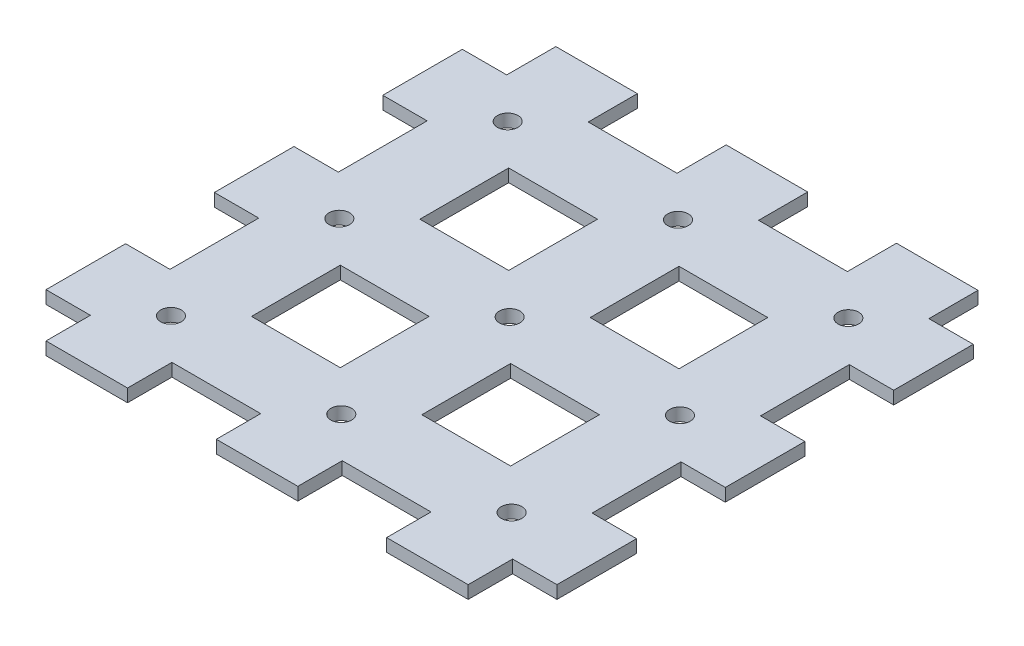
from build123d import *

# Parameters (mm, degrees)
SKETCH2_W           = 126.6
SKETCH2_H           = 126.33
BOSS_EXTRUDE1_DEPTH = 3.175
SKETCH3_W           = 22
SKETCH3_H           = 22
CUT_EXTRUDE1_DEPTH  = 90.48065629
SKETCH4_R           = 2.55
CUT_EXTRUDE2_DEPTH  = 90.48065629


with BuildPart() as part:
    # Sketch2 → Boss-Extrude1 (new body)
    with BuildSketch(Plane(origin=(0, 0, 0), x_dir=(1, 0, 0), z_dir=(0, 1, 0))):
        Rectangle(SKETCH2_W, SKETCH2_H)
    extrude(amount=BOSS_EXTRUDE1_DEPTH)

    # Sketch3 → Cut-Extrude1 (cut, through all)
    with BuildSketch(Plane(origin=(0, 3.175, 0), x_dir=(1, 0, 0), z_dir=(0, 1, 0))):
        with Locations((63.3, -63.165)):
            Rectangle(SKETCH3_W, SKETCH3_H)
        with Locations((21.1, -63.165)):
            Rectangle(SKETCH3_W, SKETCH3_H)
        with Locations((-21.1, -63.165)):
            Rectangle(SKETCH3_W, SKETCH3_H)
        with Locations((-63.3, -63.165)):
            Rectangle(SKETCH3_W, SKETCH3_H)
        with Locations((21.1, -21.445)):
            Rectangle(SKETCH3_W, SKETCH3_H)
        with Locations((-21.1, -21.445)):
            Rectangle(SKETCH3_W, SKETCH3_H)
        with Locations((-63.3, -21.445)):
            Rectangle(SKETCH3_W, SKETCH3_H)
        with Locations((21.1, 20.275)):
            Rectangle(SKETCH3_W, SKETCH3_H)
        with Locations((-21.1, 20.275)):
            Rectangle(SKETCH3_W, SKETCH3_H)
        with Locations((-63.3, 20.275)):
            Rectangle(SKETCH3_W, SKETCH3_H)
        with Locations((21.1, 61.995)):
            Rectangle(SKETCH3_W, SKETCH3_H)
        with Locations((-21.1, 61.995)):
            Rectangle(SKETCH3_W, SKETCH3_H)
        with Locations((-63.3, 61.995)):
            Rectangle(SKETCH3_W, SKETCH3_H)
        with Locations((63.3, -21.445)):
            Rectangle(SKETCH3_W, SKETCH3_H)
        with Locations((63.3, 20.275)):
            Rectangle(SKETCH3_W, SKETCH3_H)
        with Locations((63.3, 61.995)):
            Rectangle(SKETCH3_W, SKETCH3_H)
    extrude(amount=-CUT_EXTRUDE1_DEPTH, mode=Mode.SUBTRACT)

    # Sketch4 → Cut-Extrude2 (cut, through all)
    with BuildSketch(Plane(origin=(0, 3.175, 0), x_dir=(1, 0, 0), z_dir=(0, 1, 0))):
        with Locations(Location((42.2, -42.305, 0), (0, 0, 270))):
            Circle(SKETCH4_R)
        with Locations(Location((0, -42.305, 0), (0, 0, 270))):
            Circle(SKETCH4_R)
        with Locations(Location((-42.2, -42.305, 0), (0, 0, 270))):
            Circle(SKETCH4_R)
        with Locations(Location((0, -0.585, 0), (0, 0, 270))):
            Circle(SKETCH4_R)
        with Locations(Location((-42.2, -0.585, 0), (0, 0, 270))):
            Circle(SKETCH4_R)
        with Locations(Location((0, 41.135, 0), (0, 0, 270))):
            Circle(SKETCH4_R)
        with Locations(Location((-42.2, 41.135, 0), (0, 0, 270))):
            Circle(SKETCH4_R)
        with Locations(Location((42.2, -0.585, 0), (0, 0, 270))):
            Circle(SKETCH4_R)
        with Locations(Location((42.2, 41.135, 0), (0, 0, 270))):
            Circle(SKETCH4_R)
    extrude(amount=-CUT_EXTRUDE2_DEPTH, mode=Mode.SUBTRACT)


solid = part.part
